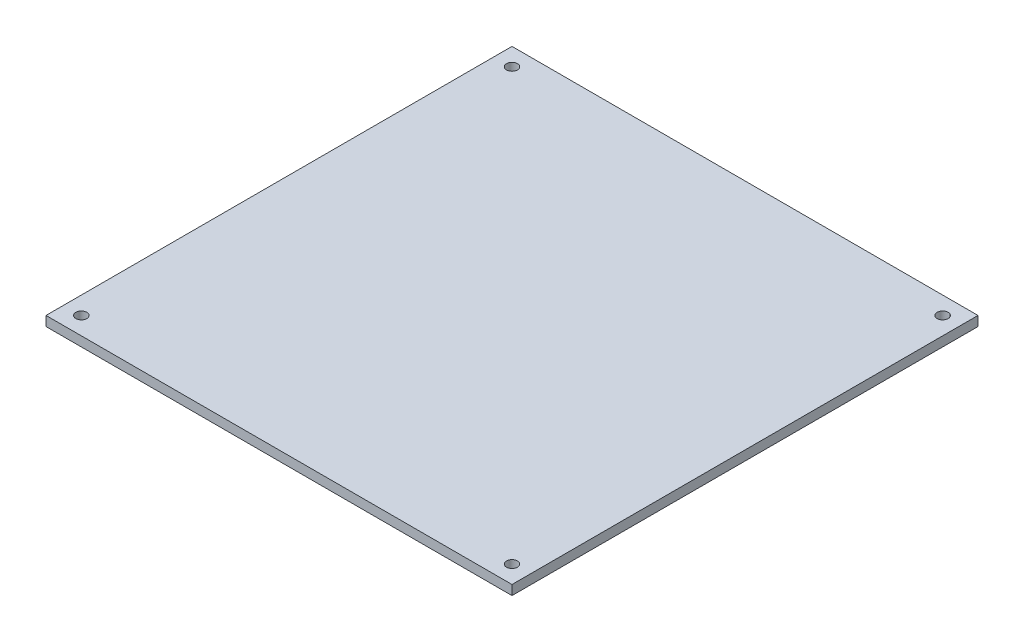
from build123d import *

# Parameters (mm, degrees)
SKETCH1_W           = 145
SKETCH1_H           = 145
BOSS_EXTRUDE1_DEPTH = 3
SKETCH2_R           = 1.705
CUT_EXTRUDE1_DEPTH  = 206.082910063


with BuildPart() as part:
    # Sketch1 → Boss-Extrude1 (new body)
    with BuildSketch(Plane(origin=(0, 0, 0), x_dir=(1, 0, 0), z_dir=(0, 1, 0))):
        with Locations((72.5, 72.5)):
            Rectangle(SKETCH1_W, SKETCH1_H)
    extrude(amount=BOSS_EXTRUDE1_DEPTH)

    # Sketch2 → Cut-Extrude1 (cut, through all)
    with BuildSketch(Plane(origin=(0, 3, 0), x_dir=(1, 0, 0), z_dir=(0, 1, 0))):
        with Locations(Location((5.5, 5.5, 0), (0, 0, 270))):
            Circle(SKETCH2_R)
        with Locations(Location((139.5, 5.5, 0), (0, 0, 90))):
            Circle(SKETCH2_R)
        with Locations(Location((5.5, 139.5, 0), (0, 0, 90))):
            Circle(SKETCH2_R)
        with Locations(Location((139.5, 139.5, 0), (0, 0, 270))):
            Circle(SKETCH2_R)
    extrude(amount=-CUT_EXTRUDE1_DEPTH, mode=Mode.SUBTRACT)


solid = part.part
